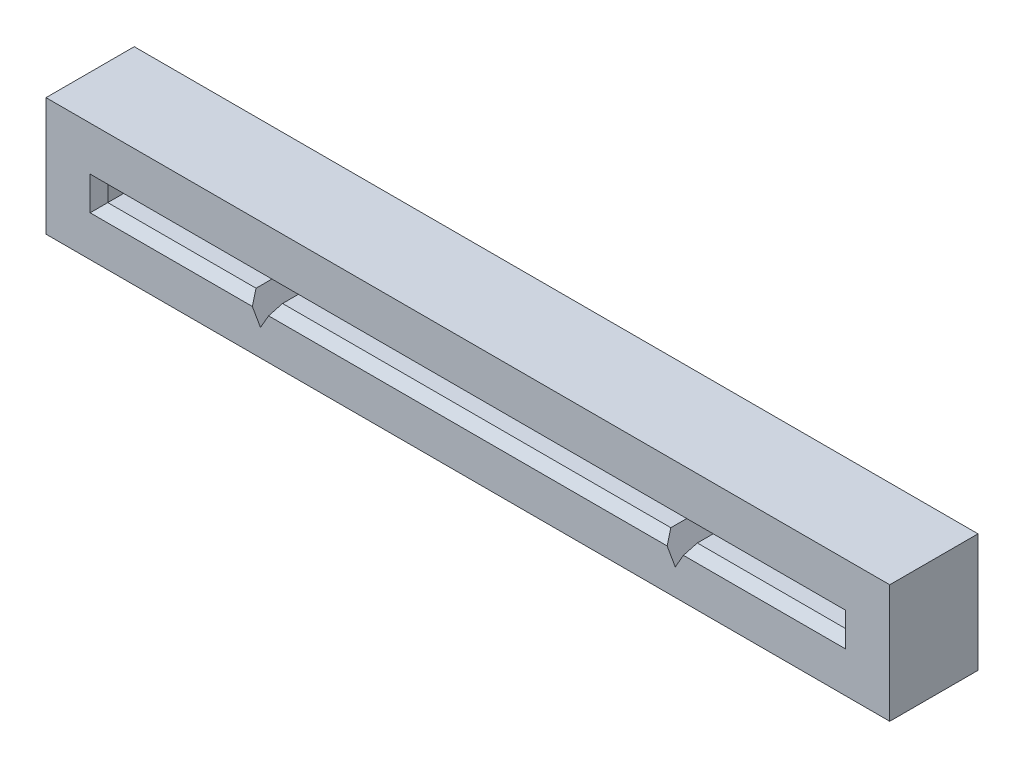
from build123d import *

# Parameters (mm, degrees)
SKETCH_1_W      = 47.8
SKETCH_1_H      = 6.7
EXTRUDE_1_DEPTH = 5
CHAMFER_1_SIZE  = 0.5


with BuildPart() as part:
    # Эскиз1 → Бобышка-Вытянуть1 (new body)
    with BuildSketch(Plane(origin=(0, 66.754264805, 0), x_dir=(-1, 0, 0), z_dir=(0, 0, 1))):
        with Locations((0, 66.654264805)):
            Rectangle(SKETCH_1_W, SKETCH_1_H)
        Polygon((-20.9, 67.204264805), (-20.9, 66.304264805), (20.9, 66.304264805), (20.9, 67.204264805), (12.5, 67.204264805), (11.75, 68.504264805), (11, 67.204264805), (-11, 67.204264805), (-11.75, 68.504264805), (-12.5, 67.204264805), align=None, mode=Mode.SUBTRACT)
    extrude(amount=EXTRUDE_1_DEPTH)

    # Фаска1
    chamfer_1_edges = [part.edges().sort_by_distance(p)[0] for p in [
        (16.7, -0.45, 5),
        (20.9, 0, 5),
        (0, 0.45, 5),
        (-20.9, 0, 5),
        (-16.7, -0.45, 5),
        (0, -0.45, 5),
    ]]
    chamfer(chamfer_1_edges, length=CHAMFER_1_SIZE)


solid = part.part
